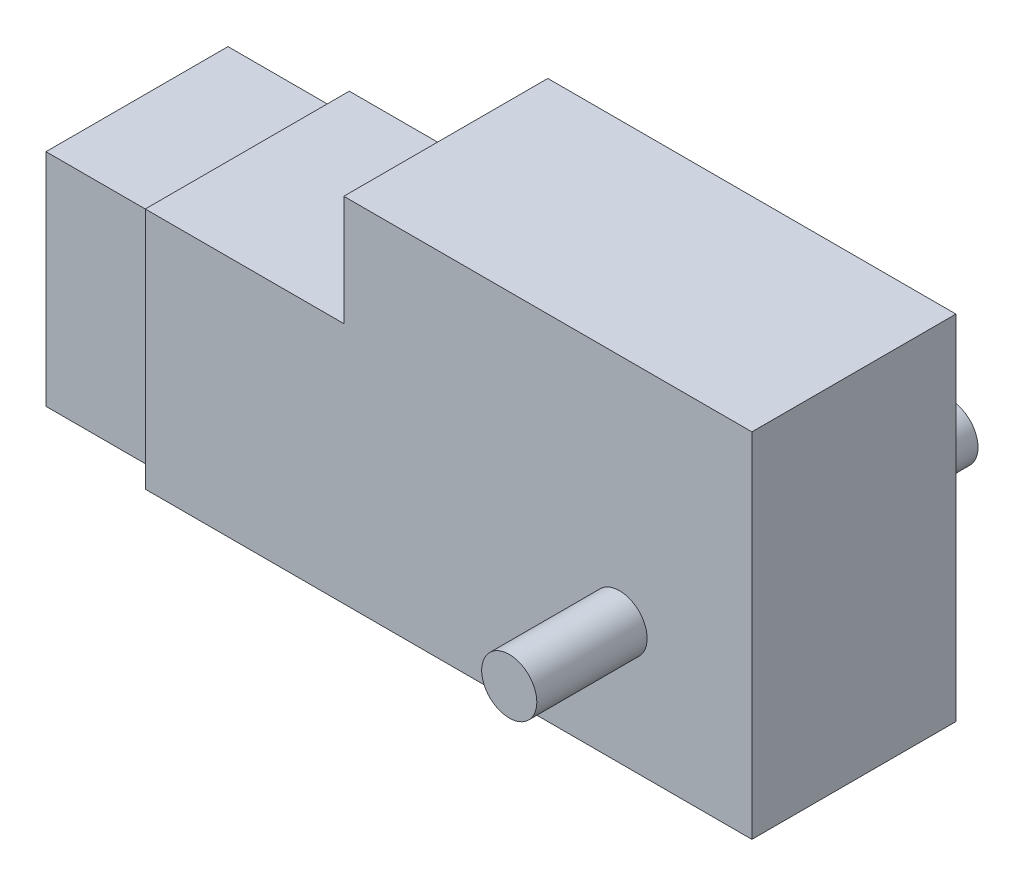
from build123d import *

# Parameters (mm, degrees)
SKETCH1_W                = 55
SKETCH1_H                = 18.5
BOSS_EXTRUDE1_DEPTH      = 22
SKETCH2_W                = 16.5
SKETCH2_H                = 20
BOSS_EXTRUDE2_DEPTH      = 10
BOSS_EXTRUDE3_DEPTH      = 10
BOSS_EXTRUDE3_DEPTH_BACK = 30
SKETCH5_R                = 2.5
SKETCH6_W                = 37
SKETCH6_H                = 18.5
BOSS_EXTRUDE4_DEPTH      = 10


with BuildPart() as part:
    # Sketch1 → Boss-Extrude1 (new body)
    with BuildSketch(Plane(origin=(0, 0, 0), x_dir=(1, 0, 0), z_dir=(0, 1, 0))):
        Rectangle(SKETCH1_W, SKETCH1_H)
    extrude(amount=BOSS_EXTRUDE1_DEPTH)

    # Sketch2 → Boss-Extrude2 (add)
    with BuildSketch(Plane.ZY.offset(27.5)):
        with Locations((0, 11)):
            Rectangle(SKETCH2_W, SKETCH2_H)
    extrude(amount=BOSS_EXTRUDE2_DEPTH)

    # Sketch5 → Boss-Extrude3 (add, two sides: drawn at the far end of the back side and taken through both)
    with BuildSketch(Plane.XY.offset(9.25).offset(-BOSS_EXTRUDE3_DEPTH_BACK)):
        with Locations((15.5, 11.027980953)):
            Circle(SKETCH5_R)
    extrude(amount=BOSS_EXTRUDE3_DEPTH + BOSS_EXTRUDE3_DEPTH_BACK)

    # Sketch6 → Boss-Extrude4 (add)
    with BuildSketch(Plane(origin=(0, 22, 0), x_dir=(1, 0, 0), z_dir=(0, 1, 0))):
        with Locations((9, 0)):
            Rectangle(SKETCH6_W, SKETCH6_H)
    extrude(amount=BOSS_EXTRUDE4_DEPTH)


solid = part.part
